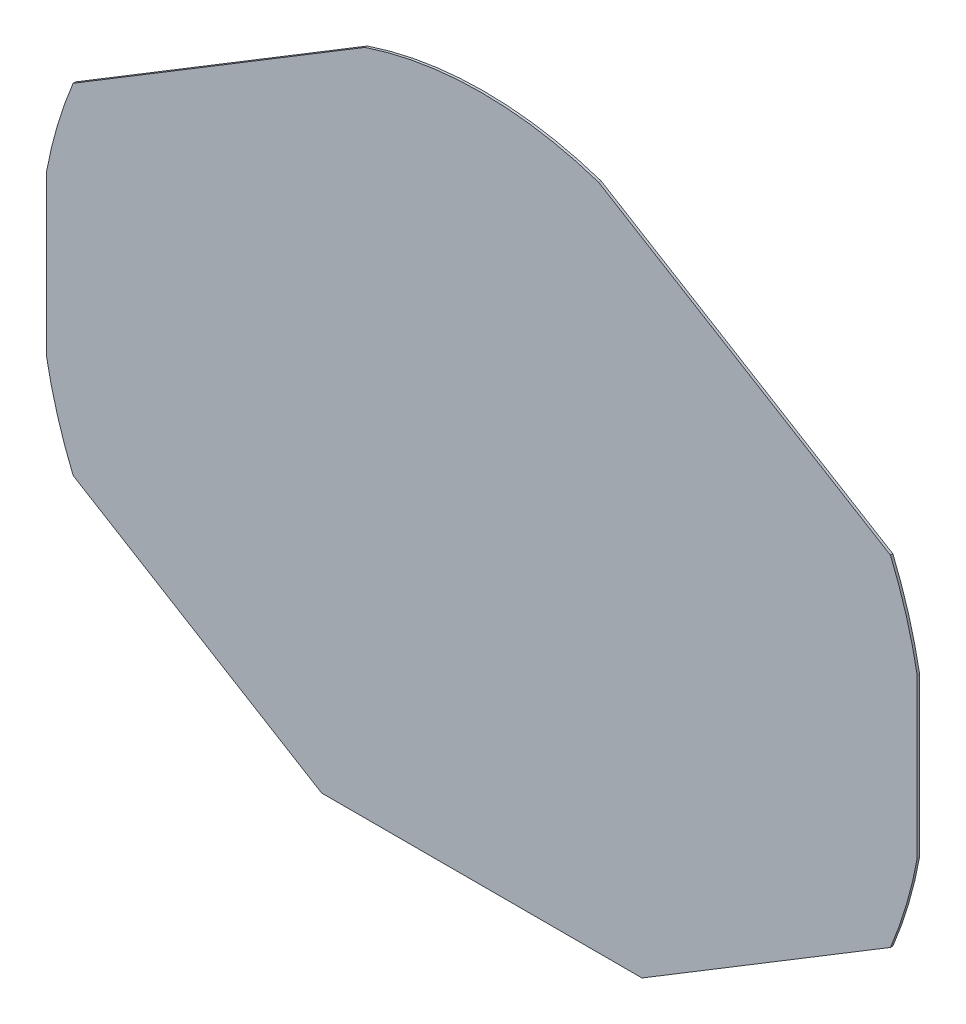
from build123d import *

# Parameters (mm, degrees)
BOSS_EXTRU_1_DEPTH = 0.05


with BuildPart() as part:
    # Esquisse1 → Boss.-Extru.1 (new body)
    with BuildSketch(Plane.XY):
        with BuildLine():
            Line((9.1, 1.659066002), (9.1, -1.659066002))
            ThreePointArc((9.1, -1.659066002), (8.871356868, -2.619451721), (8.541662602, -3.55))
            Line((8.541662602, -3.55), (3.348120127, -6.7))
            Line((3.348120127, -6.7), (-3.348120127, -6.7))
            Line((-3.348120127, -6.7), (-8.541662602, -3.55))
            ThreePointArc((-8.541662602, -3.55), (-8.871356868, -2.619451721), (-9.1, -1.659066002))
            Line((-9.1, -1.659066002), (-9.1, 1.659066002))
            ThreePointArc((-9.1, 1.659066002), (-8.871356868, 2.619451721), (-8.541662602, 3.55))
            Line((-8.541662602, 3.55), (-2.441311123, 7.25))
            ThreePointArc((-2.441311123, 7.25), (0, 7.65), (2.441311123, 7.25))
            Line((2.441311123, 7.25), (8.541662602, 3.55))
            ThreePointArc((8.541662602, 3.55), (8.871356868, 2.619451721), (9.1, 1.659066002))
        make_face()
    extrude(amount=BOSS_EXTRU_1_DEPTH)


solid = part.part
